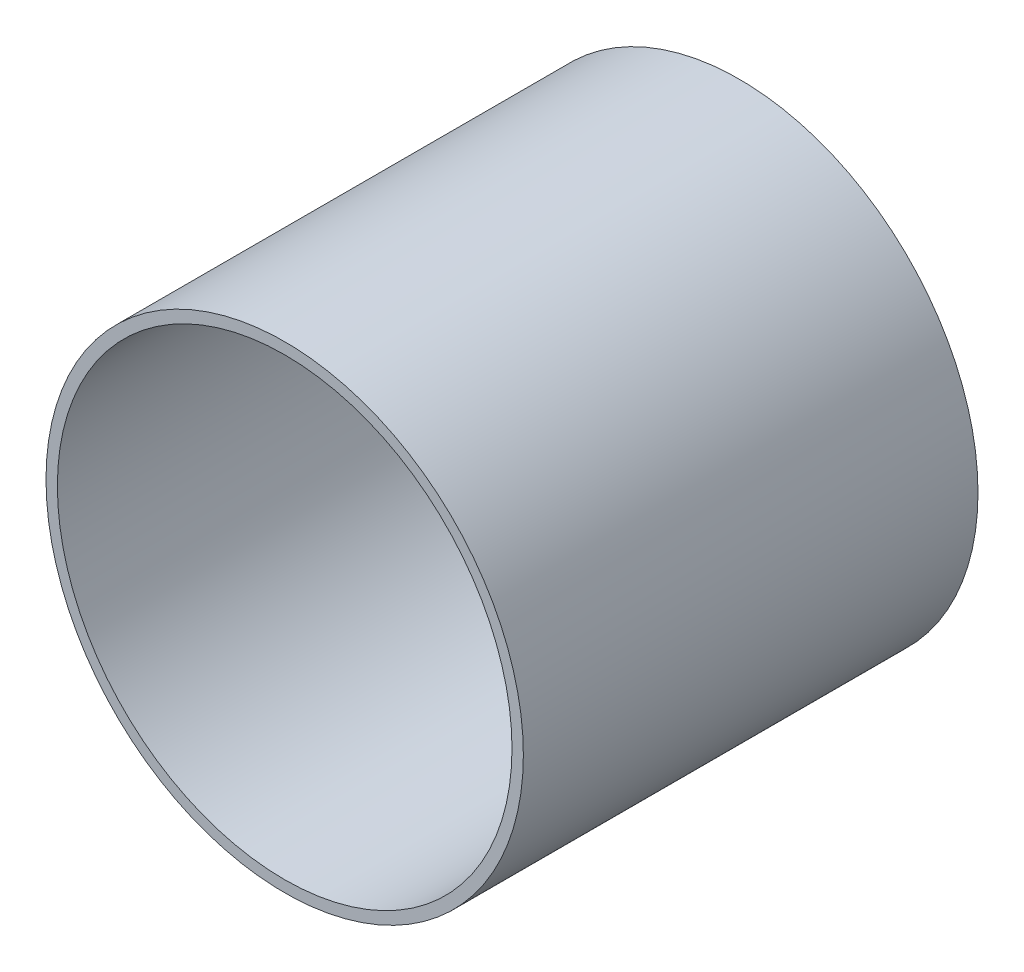
from build123d import *

# Parameters (mm, degrees)
IZIM1_R                     = 21
IZIM1_R_2                   = 20
Y_KSEKLIK_EKSTR_ZYON1_DEPTH = 40


with BuildPart() as part:
    # Çizim1 → Yükseklik-Ekstrüzyon1 (new body)
    with BuildSketch(Plane.XY):
        Circle(IZIM1_R)
        Circle(IZIM1_R_2, mode=Mode.SUBTRACT)
    extrude(amount=Y_KSEKLIK_EKSTR_ZYON1_DEPTH)


solid = part.part
